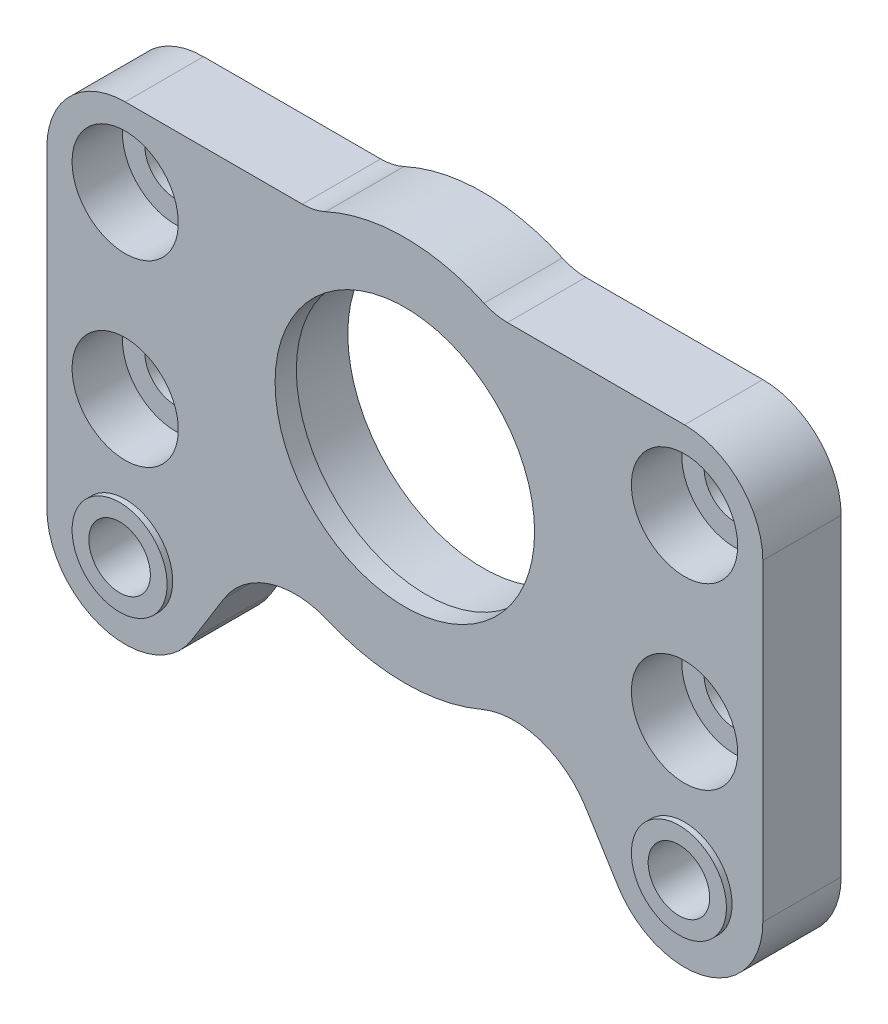
from build123d import *
from build123d.topology import SkipClean

# Parameters (mm, degrees)
BOSS_EXTRUDE1_DEPTH     = 3.5
CUT_EXTRUDE1_DEPTH      = 43.449971699
CUT_EXTRUDE1_DEPTH_BACK = 43.449971699
SKETCH3_R               = 2.75
SKETCH4_R               = 12.1
CUT_EXTRUDE2_DEPTH      = 5.1
BOSS_EXTRUDE2_START     = 0.5
SKETCH5_R               = 4.25
SKETCH5_R_2             = 2.75
BOSS_EXTRUDE2_DEPTH     = 0.5
SKETCH6_R               = 4.75
CUT_EXTRUDE3_DEPTH      = 4.5
FILLET1_R               = 5
CUT_EXTRUDE4_DEPTH      = 3.5


with BuildPart() as part:
    # Sketch1 → Boss-Extrude1 (new, symmetric)
    with BuildSketch(Plane.XY):
        with BuildLine():
            Line((32.00000152, 7.999997932), (32.00000152, -20))
            ThreePointArc((32.00000152, -20), (26.918315181, -26.732018471), (19.051409321, -23.689749429))
            Line((19.051409321, -23.689749429), (16.171450613, -19.04669704))
            ThreePointArc((16.171450613, -19.04669704), (12.060484849, -15.849407252), (6.85857128, -16.1))
            ThreePointArc((6.85857128, -16.1), (3.5, -17.146428199), (0, -17.5))
            Line((0, -17.5), (0, -11.6))
            ThreePointArc((0, -11.6), (11.6, 0), (0, 11.6))
            Line((0, 11.6), (0, 17))
            ThreePointArc((0, 17), (4.123105626, 16.492422502), (8, 15))
            Line((8, 15), (25.00000152, 15))
            ThreePointArc((25.00000152, 15), (29.949750451, 12.949746862), (32.00000152, 7.999997932))
        make_face()
    extrude(amount=BOSS_EXTRUDE1_DEPTH, both=True)

    # Sketch3 → Cut-Extrude1 (cut, two sides: drawn at the far end of the back side and taken through both)
    with BuildSketch(Plane.XY.offset(3.5).offset(-CUT_EXTRUDE1_DEPTH_BACK)):
        with Locations((25.00000152, 7.999998966)):
            Circle(SKETCH3_R)
        with Locations((25.00000152, -8.000001034)):
            Circle(SKETCH3_R)
        with Locations((25.00000152, -20.000001034)):
            Circle(SKETCH3_R)
    extrude(amount=CUT_EXTRUDE1_DEPTH + CUT_EXTRUDE1_DEPTH_BACK, mode=Mode.SUBTRACT)

    # Sketch4 → Cut-Extrude2 (cut)
    with BuildSketch(Plane(origin=(0, 0, -3.5), x_dir=(-1, 0, 0), z_dir=(0, 0, -1))):
        Circle(SKETCH4_R)
    extrude(amount=-CUT_EXTRUDE2_DEPTH, mode=Mode.SUBTRACT)

    # Sketch5 → Boss-Extrude2 (add)
    with BuildSketch(Plane.XY.offset(3.5).offset(BOSS_EXTRUDE2_START)):
        with Locations((25.00000152, -20.000001034)):
            Circle(SKETCH5_R)
        with Locations((25.00000152, -20.000001034)):
            Circle(SKETCH5_R_2, mode=Mode.SUBTRACT)
    extrude(amount=-BOSS_EXTRUDE2_DEPTH)

    # Sketch6 → Cut-Extrude3 (cut)
    with BuildSketch(Plane.XY.offset(3.5)):
        with Locations((25.00000152, -8.000001034)):
            Circle(SKETCH6_R)
        with Locations((25.00000152, 7.999998966)):
            Circle(SKETCH6_R)
    extrude(amount=-CUT_EXTRUDE3_DEPTH, mode=Mode.SUBTRACT)

    # Fillet1
    fillet1_edges = [part.edges().sort_by_distance(p)[0] for p in [
        (8, 15, 0),
    ]]
    fillet(fillet1_edges, radius=FILLET1_R)

    # Sketch8 → Cut-Extrude4 (cut)
    with BuildSketch(Plane(origin=(0, 0, -3.5), x_dir=(-1, 0, 0), z_dir=(0, 0, -1))):
        Polygon((-22.546262876, -15.750001034), (-27.453740164, -15.750001034), (-29.907478808, -20.000001034), (-27.453740164, -24.250001034), (-22.546262876, -24.250001034), (-20.092524232, -20.000001034), align=None)
    extrude(amount=-CUT_EXTRUDE4_DEPTH, mode=Mode.SUBTRACT)

    # Mirror2: part across plane


with BuildPart() as part_1:
    with SkipClean():  # the faces are left unmerged after this step: merging them gives an invalid solid
        add(part.part)
        add(part.part.mirror(Plane(origin=(0, 17, 3.5), x_dir=(0, 0, 1), z_dir=(1, 0, 0))))


solid = part_1.part
